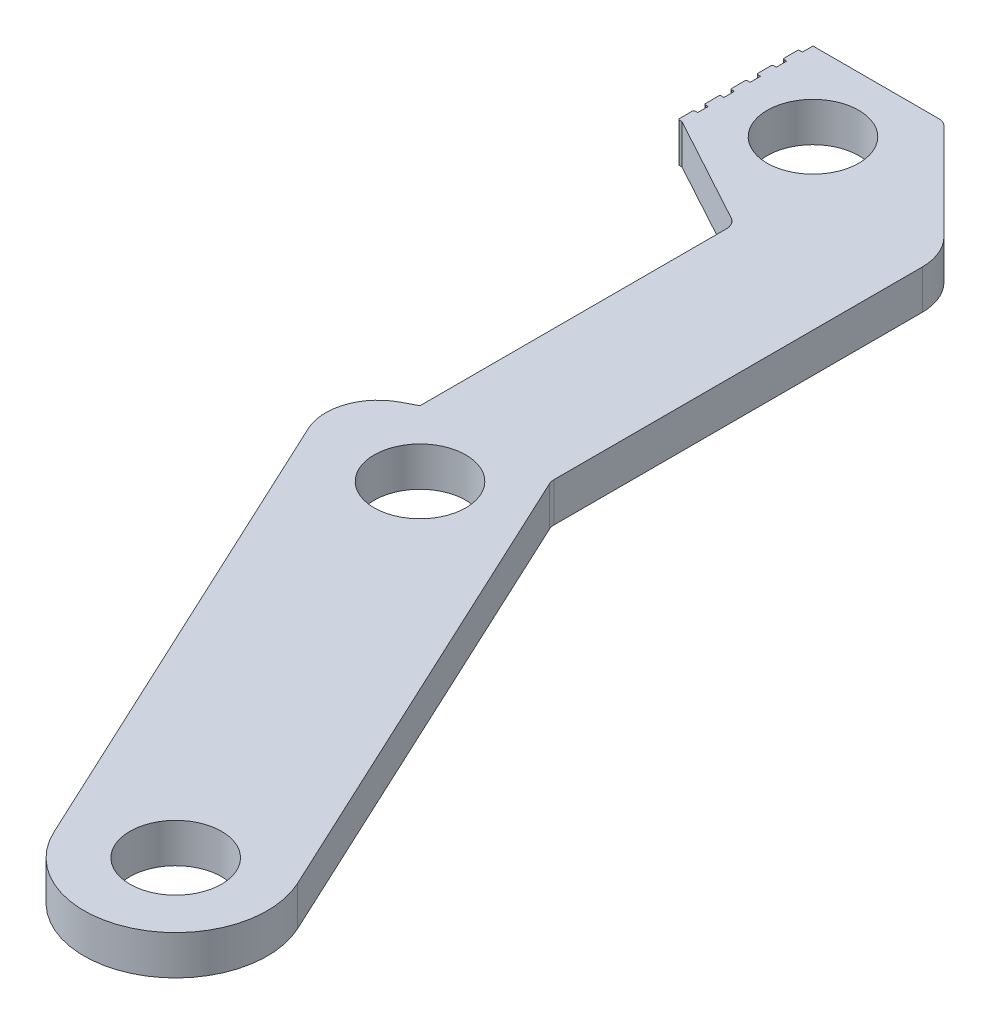
from build123d import *

# Parameters (mm, degrees)
SKETCH1_R           = 1.75
BOSS_EXTRUDE1_DEPTH = 0.75
FILLET1_R           = 2
FILLET2_R           = 0.5
SKETCH2_W           = 0.6
SKETCH2_H           = 1.5
BOSS_EXTRUDE2_DEPTH = 0.15
FILLET3_R           = 0.05


with BuildPart() as part:
    # Sketch1 → Boss-Extrude1 (new, symmetric)
    with BuildSketch(Plane(origin=(0, 0, 0), x_dir=(1, 0, 0), z_dir=(0, 1, 0))):
        with BuildLine():
            Line((-2.5, 12), (-2.5, 0))
            Line((-2.5, 0), (-4.689391033, -1.145712258))
            Line((-4.689391033, -1.145712258), (4.608210726, -21.084483573))
            ThreePointArc((4.608210726, -21.084483573), (9.259451896, -22.777396911), (10.952365235, -18.126155741))
            Line((10.952365235, -18.126155741), (2.5, 0))
            Line((2.5, 0), (2.5, 15))
            Line((2.5, 15), (-1.891164992, 19.391164992))
            Line((-1.891164992, 19.391164992), (-6.891164992, 19.391164992))
            Line((-6.891164992, 19.391164992), (-6.891164992, 14.391164992))
            Line((-6.891164992, 14.391164992), (-2.5, 12))
        make_face()
        with Locations(Location((-3.891164992, 16.391164992, 0), (0, 0, 270))):
            Circle(SKETCH1_R, mode=Mode.SUBTRACT)
        with Locations(Location((0, -2.5, 0), (0, 0, 270))):
            Circle(SKETCH1_R, mode=Mode.SUBTRACT)
        with Locations(Location((7.78028798, -19.605319657, 0), (0, 0, 270))):
            Circle(SKETCH1_R, mode=Mode.SUBTRACT)
    extrude(amount=BOSS_EXTRUDE1_DEPTH, both=True)

    # Fillet1
    fillet1_edges = [part.edges().sort_by_distance(p)[0] for p in [
        (2.5, 0, -15),
        (-4.689391033, 0, 1.145712258),
    ]]
    fillet(fillet1_edges, radius=FILLET1_R)

    # Fillet2
    fillet2_edges = [part.edges().sort_by_distance(p)[0] for p in [
        (-1.891164992, 0, -19.391164992),
        (2.5, 0, 0),
        (-2.5, 0, -12),
    ]]
    fillet(fillet2_edges, radius=FILLET2_R)

    # Sketch2 → Boss-Extrude2 (add)
    with BuildSketch(Plane.ZY.offset(6.891164992)):
        with Locations((-14.691164992, 0)):
            Rectangle(SKETCH2_W, SKETCH2_H)
        with Locations((-15.691164992, 0)):
            Rectangle(SKETCH2_W, SKETCH2_H)
        with Locations((-16.691164992, 0)):
            Rectangle(SKETCH2_W, SKETCH2_H)
        with Locations((-17.691164992, 0)):
            Rectangle(SKETCH2_W, SKETCH2_H)
        with Locations((-18.691164992, 0)):
            Rectangle(SKETCH2_W, SKETCH2_H)
    extrude(amount=BOSS_EXTRUDE2_DEPTH)

    # Fillet3
    fillet3_edges = [part.edges().sort_by_distance(p)[0] for p in [
        (-7.041164992, 0, -16.991164992),
        (-7.041164992, 0, -16.391164992),
        (-7.041164992, 0, -17.991164992),
        (-7.041164992, 0, -17.391164992),
        (-7.041164992, 0, -18.991164992),
        (-7.041164992, 0, -18.391164992),
        (-7.041164992, 0, -14.991164992),
        (-7.041164992, 0, -14.391164992),
        (-7.041164992, 0, -15.991164992),
        (-7.041164992, 0, -15.391164992),
    ]]
    fillet(fillet3_edges, radius=FILLET3_R)


solid = part.part
